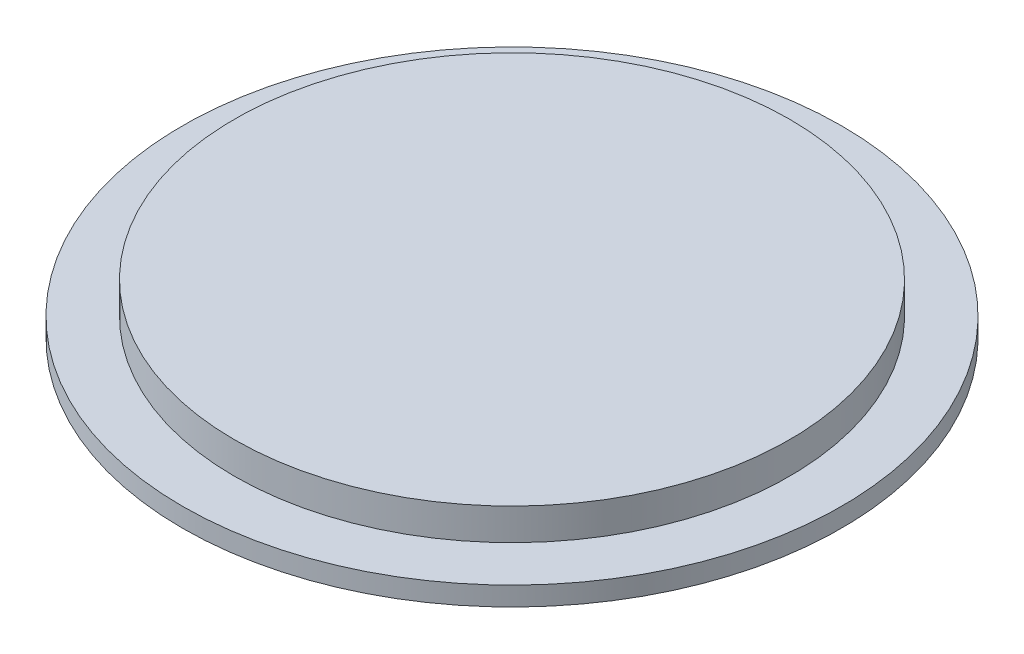
from build123d import *

# Parameters (mm, degrees)
SKETCH1_R           = 52
BOSS_EXTRUDE1_DEPTH = 3
SKETCH2_R           = 43.8
BOSS_EXTRUDE2_DEPTH = 5


with BuildPart() as part:
    # Sketch1 → Boss-Extrude1 (new body)
    with BuildSketch(Plane(origin=(0, 0, 0), x_dir=(1, 0, 0), z_dir=(0, 1, 0))):
        with Locations(Location((0, 0, 0), (0, 0, 270))):
            Circle(SKETCH1_R)
    extrude(amount=BOSS_EXTRUDE1_DEPTH)

    # Sketch2 → Boss-Extrude2 (add)
    with BuildSketch(Plane(origin=(0, 3, 0), x_dir=(1, 0, 0), z_dir=(0, 1, 0))):
        with Locations(Location((0, 0, 0), (0, 0, 270))):
            Circle(SKETCH2_R)
    extrude(amount=BOSS_EXTRUDE2_DEPTH)


solid = part.part
